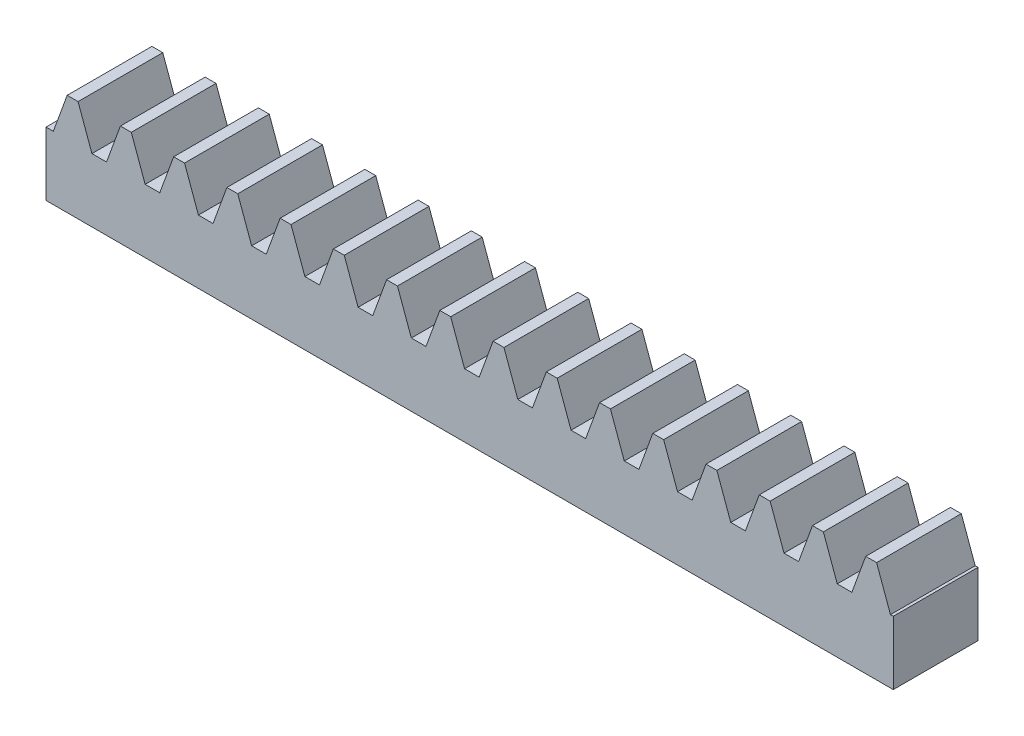
from build123d import *

# Parameters (mm, degrees)
BLANKSKE_W        = 100
BLANKSKE_H        = 12
BLANK_DEPTH       = 10
TOOTHCUTSIM_DEPTH = 102.212647431
TEETHCUTS_COUNT   = 17
TEETHCUTS_PITCH   = 6.2831853


with BuildPart() as part:
    # BlankSke → Blank (new body)
    with BuildSketch(Plane.XY):
        with Locations((50, 6)):
            Rectangle(BLANKSKE_W, BLANKSKE_H)
    extrude(amount=-BLANK_DEPTH)

    # TooCutSkeSim → ToothCutSim (cut, through all)
    with BuildSketch(Plane.XY):
        Polygon((0.861870739, 7.5), (-0.861870739, 7.5), (-2.508981637, 12.0254), (2.508981637, 12.0254), align=None)
    toothcutsim = extrude(amount=-TOOTHCUTSIM_DEPTH, mode=Mode.SUBTRACT)

    # TeethCuts: ToothCutSim ×17
    with Locations(*[(i * TEETHCUTS_PITCH, 0, 0) for i in range(1, TEETHCUTS_COUNT)]):
        add(toothcutsim, mode=Mode.SUBTRACT)


solid = part.part
